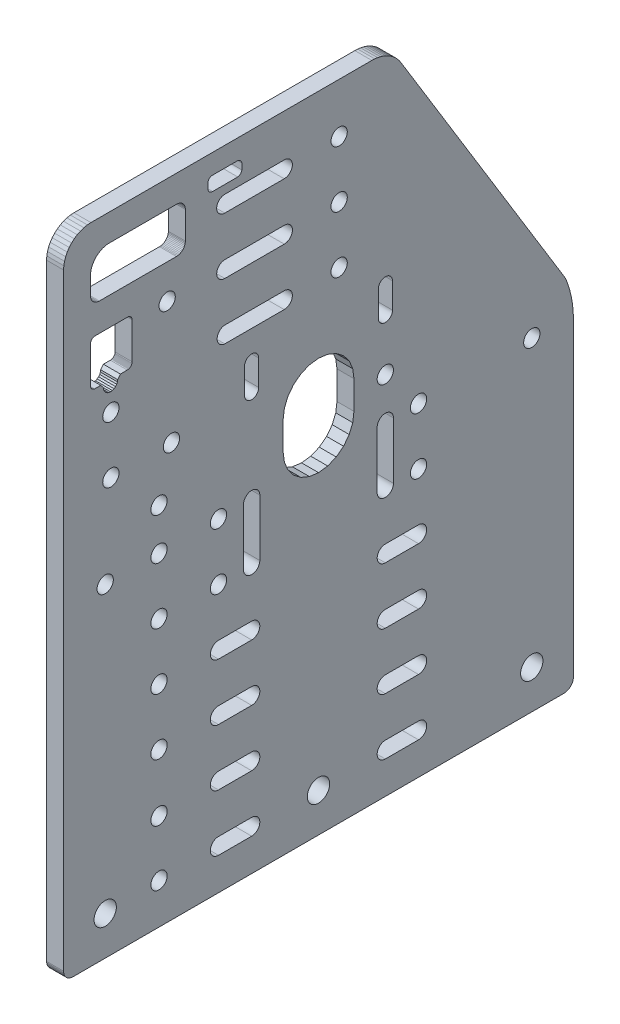
from build123d import *

# Parameters (mm, degrees)
SKETCH1_R           = 3.9435
SKETCH1_R_2         = 2.875
BOSS_EXTRUDE1_DEPTH = 6
SKETCH2_R           = 2.875
CUT_EXTRUDE3_DEPTH  = 1779.046328539


with BuildPart() as part:
    # Sketch1 → Boss-Extrude1 (new body)
    with BuildSketch(Plane(origin=(0, 0, 0), x_dir=(0, -1, 0), z_dir=(-1, 0, 0))):
        Polygon((-590.212112636, -1614.243728334), (-495.230350852, -1672.335619946), (-492.985489602, -1673.198794727), (-490.688058814, -1673.910331453), (-488.34828871, -1674.467061724), (-485.976598042, -1674.866506478), (-483.583547703, -1675.10688703), (-481.179793697, -1675.18713299), (-371.826596113, -1675.18713299), (-371.387664827, -1675.158363913), (-370.956243777, -1675.072548931), (-370.539714696, -1674.931156361), (-370.145204514, -1674.736605469), (-369.779463407, -1674.492225074), (-369.448749309, -1674.202196594), (-369.158720829, -1673.871482496), (-368.914340435, -1673.50574139), (-368.719789543, -1673.111231207), (-368.578396973, -1672.694702127), (-368.49258199, -1672.263281077), (-368.463812914, -1671.82434979), (-368.463812914, -1498.50991619), (-368.49258199, -1498.070984903), (-368.578396973, -1497.639563853), (-368.719789543, -1497.223034773), (-368.914340435, -1496.82852459), (-369.158720829, -1496.462783484), (-369.448749309, -1496.132069386), (-369.779463407, -1495.842040906), (-370.145204514, -1495.597660511), (-370.539714696, -1495.403109619), (-370.956243777, -1495.261717049), (-371.387664827, -1495.175902067), (-371.826596113, -1495.14713299), (-586.288106544, -1495.145619765), (-587.549717355, -1495.228301598), (-588.789742622, -1495.474950056), (-589.98696498, -1495.881344878), (-591.12089944, -1496.440532473), (-592.172143895, -1497.142944902), (-593.122711102, -1497.976563587), (-593.956336446, -1498.927124952), (-594.658756242, -1499.978364486), (-595.217951782, -1501.112295027), (-595.624354993, -1502.309514537), (-595.87101214, -1503.549538076), (-595.953702813, -1504.811148308), (-595.953702813, -1603.994310614), (-595.910202971, -1605.015955139), (-595.780018321, -1606.030204482), (-595.564091204, -1607.029716989), (-595.263984611, -1608.007257681), (-594.881870865, -1608.955750621), (-594.420515902, -1609.868330136), (-593.883259242, -1610.738390509), (-593.273989822, -1611.559633802), (-592.597117845, -1612.326115438), (-591.857542854, -1613.032287234), (-591.060618269, -1613.673037558), align=None)
        with Locations(Location((-382.159118976, -1509.84713299, 0), (0, 0, 90))):
            Circle(SKETCH1_R, mode=Mode.SUBTRACT)
        with Locations(Location((-382.159118976, -1585.16713299, 0), (0, 0, 90))):
            Circle(SKETCH1_R, mode=Mode.SUBTRACT)
        with Locations(Location((-382.159118976, -1660.48713299, 0), (0, 0, 90))):
            Circle(SKETCH1_R, mode=Mode.SUBTRACT)
        with Locations(Location((-538.399280751, -1592.457817223, 0), (0, 0, 90))):
            Circle(SKETCH1_R_2, mode=Mode.SUBTRACT)
        with Locations(Location((-558.44846865, -1592.457817223, 0), (0, 0, 90))):
            Circle(SKETCH1_R_2, mode=Mode.SUBTRACT)
        with Locations(Location((-578.44846865, -1592.457817223, 0), (0, 0, 90))):
            Circle(SKETCH1_R_2, mode=Mode.SUBTRACT)
        with Locations(Location((-534.443559506, -1511.847133017, 0), (0, 0, 90))):
            Circle(SKETCH1_R_2, mode=Mode.SUBTRACT)
        with Locations(Location((-558.402442437, -1531.722977175, 0), (0, 0, 90))):
            Circle(SKETCH1_R_2, mode=Mode.SUBTRACT)
        with Locations(Location((-514.443559639, -1511.847132679, 0), (0, 0, 90))):
            Circle(SKETCH1_R_2, mode=Mode.SUBTRACT)
        with Locations(Location((-514.443559639, -1533.238984755, 0), (0, 0, 90))):
            Circle(SKETCH1_R_2, mode=Mode.SUBTRACT)
        with Locations(Location((-497.496167838, -1528.847132988, 0), (0, 0, 90))):
            Circle(SKETCH1_R_2, mode=Mode.SUBTRACT)
        with Locations(Location((-482.799118976, -1549.84713299, 0), (0, 0, 90))):
            Circle(SKETCH1_R_2, mode=Mode.SUBTRACT)
        with Locations(Location((-482.799118976, -1509.84713299, 0), (0, 0, 90))):
            Circle(SKETCH1_R_2, mode=Mode.SUBTRACT)
        with Locations(Location((-482.799118976, -1620.48713299, 0), (0, 0, 90))):
            Circle(SKETCH1_R_2, mode=Mode.SUBTRACT)
        with Locations(Location((-482.799118977, -1660.487132991, 0), (0, 0, 90))):
            Circle(SKETCH1_R_2, mode=Mode.SUBTRACT)
        with Locations(Location((-402.49616799, -1528.847132989, 0), (0, 0, 90))):
            Circle(SKETCH1_R_2, mode=Mode.SUBTRACT)
        with BuildLine():
            Line((-575.227783856, -1552.077882346), (-575.227783856, -1573.050634137))
            ThreePointArc((-575.227783856, -1573.050634137), (-578.079074753, -1575.949243679), (-580.977684295, -1573.097952782))
            Line((-580.977684295, -1573.097952782), (-580.977684295, -1552.084054231))
            ThreePointArc((-580.977684295, -1552.084054231), (-578.105820018, -1549.206018069), (-575.227783856, -1552.077882346))
        make_face(mode=Mode.SUBTRACT)
        with BuildLine():
            Line((-535.227816062, -1552.079240506), (-535.227816062, -1573.051992297))
            ThreePointArc((-535.227816062, -1573.051992297), (-538.07910696, -1575.950601839), (-540.977716502, -1573.099310942))
            Line((-540.977716502, -1573.099310942), (-540.977716502, -1552.085412391))
            ThreePointArc((-540.977716502, -1552.085412391), (-538.105676332, -1549.371242649), (-535.227816062, -1552.079240506))
        make_face(mode=Mode.SUBTRACT)
        with BuildLine():
            Line((-555.227626311, -1552.095047321), (-555.227626311, -1573.081416036))
            ThreePointArc((-555.227626311, -1573.081416036), (-558.086800371, -1575.972249955), (-560.977634291, -1573.113075895))
            Line((-560.977634291, -1573.113075895), (-560.977634291, -1552.099177304))
            ThreePointArc((-560.977634291, -1552.099177304), (-558.104695292, -1549.222108322), (-555.227626311, -1552.095047321))
        make_face(mode=Mode.SUBTRACT)
        with BuildLine():
            Line((-524.913709892, -1559.055192962), (-515.913733671, -1559.055192962))
            ThreePointArc((-515.913733671, -1559.055192962), (-513.413733671, -1561.555192962), (-515.913733671, -1564.055192962))
            Line((-515.913733671, -1564.055192962), (-524.913709892, -1564.055192962))
            ThreePointArc((-524.913709892, -1564.055192962), (-527.413709892, -1561.555192962), (-524.913709892, -1559.055192962))
        make_face(mode=Mode.SUBTRACT)
        with BuildLine():
            Line((-524.913709892, -1606.299062763), (-515.913733671, -1606.299062763))
            ThreePointArc((-515.913733671, -1606.299062763), (-513.413733671, -1608.799062763), (-515.913733671, -1611.299062763))
            Line((-515.913733671, -1611.299062763), (-524.913709892, -1611.299062763))
            ThreePointArc((-524.913709892, -1611.299062763), (-527.413709892, -1608.799062763), (-524.913709892, -1606.299062763))
        make_face(mode=Mode.SUBTRACT)
        with BuildLine():
            Line((-477.66984009, -1606.299062763), (-468.669863869, -1606.299062763))
            ThreePointArc((-468.669863869, -1606.299062763), (-466.169863869, -1608.799062763), (-468.669863869, -1611.299062763))
            Line((-468.669863869, -1611.299062763), (-477.66984009, -1611.299062763))
            ThreePointArc((-477.66984009, -1611.299062763), (-480.16984009, -1608.799062763), (-477.66984009, -1606.299062763))
        make_face(mode=Mode.SUBTRACT)
        with BuildLine():
            Line((-477.669839463, -1559.052819647), (-468.669869913, -1559.05519296))
            ThreePointArc((-468.669869913, -1559.05519296), (-466.170529427, -1561.555851956), (-468.671188424, -1564.055192442))
            Line((-468.671188424, -1564.055192442), (-477.669845508, -1564.052819475))
            ThreePointArc((-477.669845508, -1564.052819475), (-480.169186252, -1561.55281654), (-477.669839463, -1559.052819647))
        make_face(mode=Mode.SUBTRACT)
        Polygon((-586.033555203, -1536.579108211), (-586.214987166, -1536.211200586), (-586.346845371, -1535.822758839), (-586.426873689, -1535.420429315), (-586.453702813, -1535.011095984), (-586.453702813, -1511.296236305), (-586.396818705, -1510.428352529), (-586.227139684, -1509.575318486), (-585.947569005, -1508.751729823), (-585.5628902, -1507.971678372), (-585.079685229, -1507.248511028), (-584.506221865, -1506.594601387), (-583.852312223, -1506.021138022), (-583.12914488, -1505.537933052), (-582.349093428, -1505.153254247), (-581.525504766, -1504.873683568), (-580.672470722, -1504.704004546), (-579.804586946, -1504.647120438), (-573.616888973, -1504.647120438), (-573.207555642, -1504.673949562), (-572.805226118, -1504.75397788), (-572.416784371, -1504.885836086), (-572.048876746, -1505.067268048), (-571.707798245, -1505.295169417), (-571.399384815, -1505.565640735), (-571.128913497, -1505.874054164), (-570.901012129, -1506.215132665), (-570.719580166, -1506.58304029), (-570.587721961, -1506.971482038), (-570.507693643, -1507.373811562), (-570.480864519, -1507.783144892), (-570.480864519, -1535.011095984), (-570.507693643, -1535.420429315), (-570.587721961, -1535.822758839), (-570.719580166, -1536.211200586), (-570.901012129, -1536.579108211), (-571.128913497, -1536.920186712), (-571.399384815, -1537.228600142), (-571.707798245, -1537.49907146), (-572.048876746, -1537.726972829), (-572.416784371, -1537.908404791), (-572.805226118, -1538.040262996), (-573.207555642, -1538.120291315), (-573.616888973, -1538.147120438), (-583.317678359, -1538.147120438), (-583.72701169, -1538.120291315), (-584.129341214, -1538.040262996), (-584.517782961, -1537.908404791), (-584.885690586, -1537.726972828), (-585.226769087, -1537.49907146), (-585.535182516, -1537.228600142), (-585.805653835, -1536.920186712), align=None, mode=Mode.SUBTRACT)
        Polygon((-560.539732338, -1505.878268758), (-560.469558584, -1505.671543545), (-560.373002121, -1505.475746407), (-560.251715057, -1505.294227488), (-560.107772647, -1505.130092628), (-559.943637786, -1504.986150218), (-559.762118868, -1504.864863154), (-559.56632173, -1504.768306692), (-559.359596516, -1504.698132937), (-559.131202133, -1504.647120439), (-558.927636825, -1504.641264366), (-548.4808636, -1504.645157132), (-545.881846575, -1504.645157132), (-545.667730411, -1504.687747485), (-545.461005198, -1504.757921239), (-545.26520806, -1504.854477702), (-545.083689141, -1504.975764766), (-544.919554281, -1505.119707176), (-544.775611871, -1505.283842037), (-544.654324807, -1505.465360956), (-544.557768345, -1505.661158094), (-544.48759459, -1505.867883307), (-544.445004238, -1506.081999471), (-544.441434684, -1508.267709423), (-543.221041992, -1509.237688263), (-542.573960137, -1509.322613597), (-541.970907354, -1509.572122279), (-541.452980696, -1509.969210703), (-541.055476008, -1510.486817951), (-540.805482577, -1511.089669943), (-540.720037042, -1511.736683313), (-540.804962376, -1512.383765169), (-541.054471058, -1512.986817951), (-541.451559482, -1513.504744609), (-541.96916673, -1513.902249297), (-542.572018722, -1514.152242729), (-543.219032092, -1514.237688263), (-544.432285676, -1515.207667102), (-544.430726027, -1517.677645941), (-544.487594599, -1518.109605632), (-544.557768353, -1518.316330846), (-544.654324816, -1518.512127983), (-544.77561188, -1518.693646902), (-544.91955429, -1518.857781763), (-545.083689151, -1519.001724172), (-545.26520807, -1519.123011236), (-545.461005208, -1519.219567699), (-545.667730421, -1519.289741453), (-546.099691027, -1519.348570172), (-558.957839921, -1519.342717258), (-559.145480362, -1519.342717258), (-559.359596526, -1519.300126905), (-559.566321739, -1519.229953151), (-559.762118877, -1519.133396688), (-559.943637796, -1519.012109624), (-560.107772656, -1518.868167214), (-560.251715066, -1518.704032353), (-560.37300213, -1518.522513435), (-560.469558592, -1518.326716297), (-560.539732347, -1518.119991083), (-560.582322699, -1517.905874919), (-560.582322699, -1517.679609247), (-560.568044472, -1506.083962777), align=None, mode=Mode.SUBTRACT)
        Polygon((-512.609294248, -1578.937135138), (-510.622811466, -1576.348300373), (-508.033976701, -1574.36181759), (-505.019214764, -1573.113062308), (-501.7839767, -1572.687135137), (-491.783976402, -1572.687135137), (-488.548738338, -1573.113062308), (-485.533976401, -1574.36181759), (-482.945141636, -1576.348300373), (-480.958658854, -1578.937135138), (-479.709903572, -1581.951897074), (-479.283976401, -1585.187135138), (-479.709903572, -1588.422373202), (-480.958658854, -1591.437135139), (-482.945141636, -1594.025969904), (-485.533976401, -1596.012452687), (-488.548738338, -1597.261207968), (-491.783976402, -1597.68713514), (-501.7839767, -1597.68713514), (-505.019214764, -1597.261207968), (-508.033976701, -1596.012452687), (-510.622811466, -1594.025969904), (-512.609294248, -1591.437135139), (-513.85804953, -1588.422373202), (-514.283976701, -1585.187135138), (-513.85804953, -1581.951897074), align=None, mode=Mode.SUBTRACT)
        with BuildLine():
            Line((-588.98086362, -1556.648178727), (-588.98086362, -1547.550419842))
            ThreePointArc((-588.98086362, -1547.550419842), (-588.50376059, -1546.590680791), (-587.544021697, -1546.113577446))
            Line((-587.544021697, -1546.113577446), (-585.643575513, -1546.099299227))
            ThreePointArc((-585.643575513, -1546.099299227), (-584.463439705, -1546.588127429), (-583.974611428, -1547.768263206))
            Line((-583.974611428, -1547.768263206), (-583.988889647, -1556.648178564))
            ThreePointArc((-583.988889647, -1556.648178564), (-584.465992569, -1557.607917612), (-585.425731394, -1558.085020984))
            Line((-585.425731394, -1558.085020984), (-587.544021696, -1558.085020984))
            ThreePointArc((-587.544021696, -1558.085020984), (-588.506313615, -1557.610470755), (-588.98086362, -1556.648178727))
        make_face(mode=Mode.SUBTRACT)
    extrude(amount=-BOSS_EXTRUDE1_DEPTH)

    # Sketch2 → Cut-Extrude3 (cut, through all)
    with BuildSketch(Plane(origin=(6, 0, 0), x_dir=(0, 0, -1), z_dir=(1, 0, 0))):
        with BuildLine():
            Line((1605.89213299, 482.799118976), (1605.89213299, 462.799118976))
            ThreePointArc((1605.89213299, 462.799118976), (1608.76713299, 459.924118976), (1611.64213299, 462.799118976))
            Line((1611.64213299, 462.799118976), (1611.64213299, 482.799118976))
            ThreePointArc((1611.64213299, 482.799118976), (1608.76713299, 485.674118976), (1605.89213299, 482.799118976))
        make_face()
        with Locations((1549.84713299, 442.799118976)):
            Circle(SKETCH2_R)
        with Locations(Location((1549.84713299, 482.799118976, 0), (0, 0, 180))):
            Circle(SKETCH2_R)
        with Locations((1549.84713299, 462.799118976)):
            Circle(SKETCH2_R)
        with Locations((1549.84713299, 422.799118976)):
            Circle(SKETCH2_R)
        with Locations((1549.84713299, 402.799118976)):
            Circle(SKETCH2_R)
        with Locations((1549.84713299, 382.799118976)):
            Circle(SKETCH2_R)
        with Locations((1561.56713299, 382.799118976)):
            Circle(SKETCH2_R)
        with Locations((1561.56713299, 402.799118976)):
            Circle(SKETCH2_R)
        with Locations((1561.56713299, 422.799118976)):
            Circle(SKETCH2_R)
        with Locations((1561.56713299, 442.799118976)):
            Circle(SKETCH2_R)
        with BuildLine():
            Line((1564.44213299, 482.799118976), (1564.44213299, 462.799118976))
            ThreePointArc((1564.44213299, 462.799118976), (1561.56713299, 459.924118976), (1558.69213299, 462.799118976))
            Line((1558.69213299, 462.799118976), (1558.69213299, 482.799118976))
            ThreePointArc((1558.69213299, 482.799118976), (1561.56713299, 485.674118976), (1564.44213299, 482.799118976))
        make_face()
        with Locations((1620.48713299, 462.799118976)):
            Circle(SKETCH2_R)
        with Locations((1608.76713299, 402.799118976)):
            Circle(SKETCH2_R)
        with Locations((1608.76713299, 382.799118976)):
            Circle(SKETCH2_R)
        with Locations((1620.48713299, 382.799118976)):
            Circle(SKETCH2_R)
        with Locations((1620.48713299, 402.799118976)):
            Circle(SKETCH2_R)
        with Locations((1620.48713299, 422.799118976)):
            Circle(SKETCH2_R)
        with Locations((1608.76713299, 422.799118976)):
            Circle(SKETCH2_R)
        with Locations((1608.76713299, 442.799118976)):
            Circle(SKETCH2_R)
        with Locations((1620.48713299, 442.799118976)):
            Circle(SKETCH2_R)
        with Locations(Location((1620.48713299, 482.799118976, 0), (0, 0, 180))):
            Circle(SKETCH2_R)
        with Locations((1608.767132988, 497.496167838)):
            Circle(SKETCH2_R)
        with Locations((1528.847132988, 382.745908718)):
            Circle(SKETCH2_R)
        with Locations((1528.847132988, 462.786116014)):
            Circle(SKETCH2_R)
        with Locations((1528.847132988, 442.77606419)):
            Circle(SKETCH2_R)
        with Locations((1528.847132988, 482.796167838)):
            Circle(SKETCH2_R)
        with Locations((1528.847132988, 422.766012366)):
            Circle(SKETCH2_R)
        with BuildLine():
            Line((1620.48713299, 445.674118976), (1608.76713299, 445.674118976))
            ThreePointArc((1608.76713299, 445.674118976), (1605.89213299, 442.799118976), (1608.76713299, 439.924118976))
            Line((1608.76713299, 439.924118976), (1620.48713299, 439.924118976))
            ThreePointArc((1620.48713299, 439.924118976), (1623.36213299, 442.799118976), (1620.48713299, 445.674118976))
        make_face()
        with BuildLine():
            Line((1620.48713299, 425.674118976), (1608.76713299, 425.674118976))
            ThreePointArc((1608.76713299, 425.674118976), (1605.89213299, 422.799118976), (1608.76713299, 419.924118976))
            Line((1608.76713299, 419.924118976), (1620.48713299, 419.924118976))
            ThreePointArc((1620.48713299, 419.924118976), (1623.36213299, 422.799118976), (1620.48713299, 425.674118976))
        make_face()
        with BuildLine():
            Line((1620.48713299, 405.674118976), (1608.76713299, 405.674118976))
            ThreePointArc((1608.76713299, 405.674118976), (1605.89213299, 402.799118976), (1608.76713299, 399.924118976))
            Line((1608.76713299, 399.924118976), (1620.48713299, 399.924118976))
            ThreePointArc((1620.48713299, 399.924118976), (1623.36213299, 402.799118976), (1620.48713299, 405.674118976))
        make_face()
        with BuildLine():
            Line((1620.48713299, 385.674118976), (1608.76713299, 385.674118976))
            ThreePointArc((1608.76713299, 385.674118976), (1605.89213299, 382.799118976), (1608.76713299, 379.924118976))
            Line((1608.76713299, 379.924118976), (1620.48713299, 379.924118976))
            ThreePointArc((1620.48713299, 379.924118976), (1623.36213299, 382.799118976), (1620.48713299, 385.674118976))
        make_face()
        with BuildLine():
            Line((1561.56713299, 385.674118976), (1549.84713299, 385.674118976))
            ThreePointArc((1549.84713299, 385.674118976), (1546.97213299, 382.799118976), (1549.84713299, 379.924118976))
            Line((1549.84713299, 379.924118976), (1561.56713299, 379.924118976))
            ThreePointArc((1561.56713299, 379.924118976), (1564.44213299, 382.799118976), (1561.56713299, 385.674118976))
        make_face()
        with BuildLine():
            Line((1561.56713299, 405.674118976), (1549.84713299, 405.674118976))
            ThreePointArc((1549.84713299, 405.674118976), (1546.97213299, 402.799118976), (1549.84713299, 399.924118976))
            Line((1549.84713299, 399.924118976), (1561.56713299, 399.924118976))
            ThreePointArc((1561.56713299, 399.924118976), (1564.44213299, 402.799118976), (1561.56713299, 405.674118976))
        make_face()
        with BuildLine():
            Line((1561.56713299, 425.674118976), (1549.84713299, 425.674118976))
            ThreePointArc((1549.84713299, 425.674118976), (1546.97213299, 422.799118976), (1549.84713299, 419.924118976))
            Line((1549.84713299, 419.924118976), (1561.56713299, 419.924118976))
            ThreePointArc((1561.56713299, 419.924118976), (1564.44213299, 422.799118976), (1561.56713299, 425.674118976))
        make_face()
        with BuildLine():
            Line((1561.56713299, 445.674118976), (1549.84713299, 445.674118976))
            ThreePointArc((1549.84713299, 445.674118976), (1546.97213299, 442.799118976), (1549.84713299, 439.924118976))
            Line((1549.84713299, 439.924118976), (1561.56713299, 439.924118976))
            ThreePointArc((1561.56713299, 439.924118976), (1564.44213299, 442.799118976), (1561.56713299, 445.674118976))
        make_face()
    extrude(amount=-CUT_EXTRUDE3_DEPTH, mode=Mode.SUBTRACT)


solid = part.part
